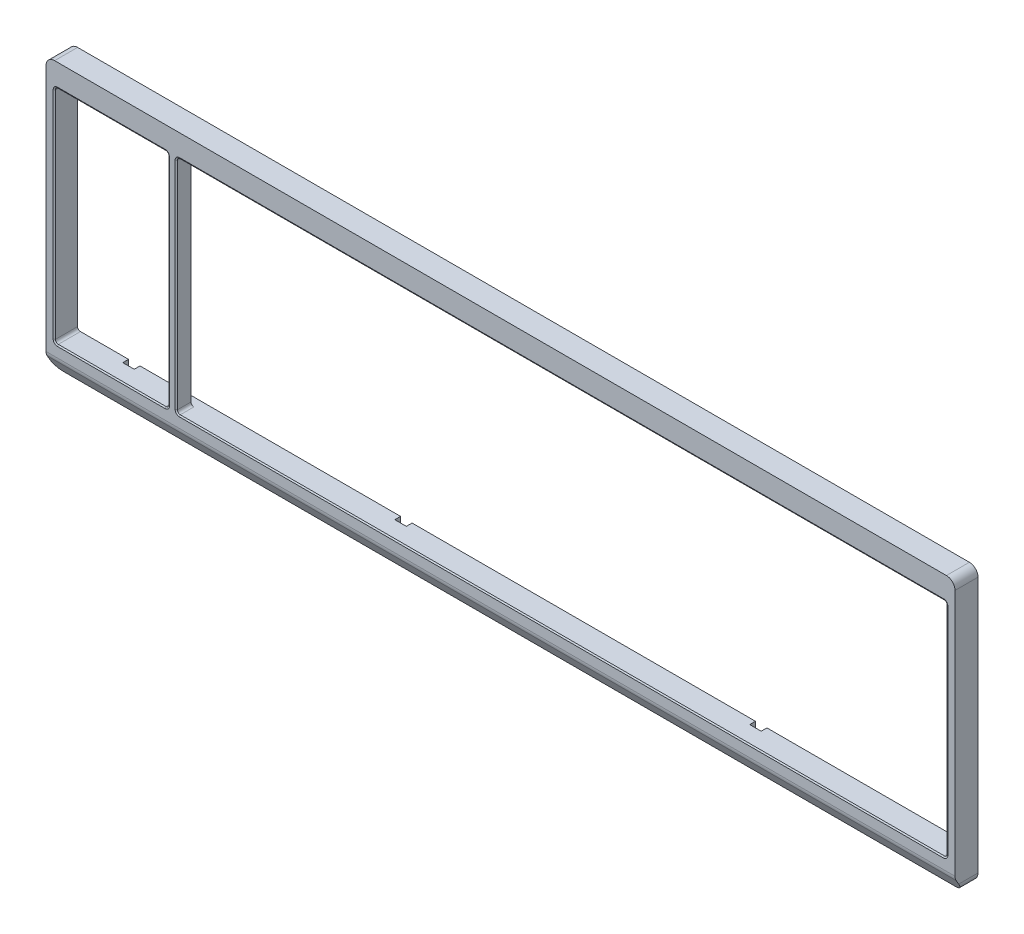
from build123d import *

# Parameters (mm, degrees)
SKETCH3_W                      = 316.5625
SKETCH3_H                      = 95.2
BOSS_EXTRUDE1_DEPTH            = 8
SKETCH3_3_W                    = 3
SKETCH3_3_H                    = 67.175
SKETCH3_3_H_2                  = 10.025
BOSS_EXTRUDE2_DEPTH            = 5
CHAMFER1_SIZE                  = 3
CHAMFER1_SIZE2                 = 5.196152423
FILLET3_R                      = 3
SKETCH8_R                      = 1.45
CUT_EXTRUDE1_DEPTH             = 2
SKETCH8_3_R                    = 1.45
CUT_EXTRUDE4_DEPTH             = 6
FILLET1_R                      = 3
FILLET5_R                      = 1
CHAMFER2_SIZE                  = 0.5
CHAMFER2_SIZE2                 = 0.288675135
FILLET6_R                      = 0.5
CBORE_FOR_M2_SHCS2_D           = 2.4
CBORE_FOR_M2_SHCS2_DEPTH       = 14.278967257
CBORE_FOR_M2_SHCS2_CBORE_D     = 4.4
CBORE_FOR_M2_SHCS2_CBORE_DEPTH = 4
CBORE_FOR_M2_SHCS2_TIP         = 0.721032743
HOLE_WIZARD_5794_D             = 2.4
HOLE_WIZARD_5794_DEPTH         = 8.278967257
HOLE_WIZARD_5794_CSINK_D       = 4.4
HOLE_WIZARD_5794_CSINK_ANGLE   = 90
HOLE_WIZARD_5794_TIP           = 0.721032743
SKETCH11_R                     = 1.45
CUT_EXTRUDE2_DEPTH             = 4
SKETCH11_3_R                   = 1.45
CUT_EXTRUDE3_DEPTH             = 4


with BuildPart() as part:
    # Sketch3 → Boss-Extrude1 (new body)
    with BuildSketch(Plane.XY):
        with Locations((154.78125, -39.1)):
            Rectangle(SKETCH3_W, SKETCH3_H)
        Polygon((38.98125, -76.7), (41.98125, -76.7), (310.0625, -76.7), (310.0625, 0.5), (41.98125, 0.5), (38.98125, 0.5), (-0.5, 0.5), (-0.5, -76.7), align=None, mode=Mode.SUBTRACT)
    extrude(amount=-BOSS_EXTRUDE1_DEPTH)

    # Sketch3<3> → Boss-Extrude2 (add)
    with BuildSketch(Plane.XY):
        with Locations((40.48125, -43.1125)):
            Rectangle(SKETCH3_3_W, SKETCH3_3_H)
        with Locations((40.48125, -4.5125)):
            Rectangle(SKETCH3_3_W, SKETCH3_3_H_2)
    extrude(amount=-BOSS_EXTRUDE2_DEPTH)

    # Chamfer1
    chamfer1_edges = [part.edges().sort_by_distance(p)[0] for p in [
        (154.78125, -86.7, 0),
    ]]
    chamfer1_side = [part.faces().sort_by_distance(p)[0] for p in [
        (154.78125, -86.7, -4),
    ]]
    chamfer(chamfer1_edges, length=CHAMFER1_SIZE, length2=CHAMFER1_SIZE2, reference=chamfer1_side[0])

    # Fillet3
    fillet3_edges = [part.edges().sort_by_distance(p)[0] for p in [
        (154.78125, -81.503847577, 0),
    ]]
    fillet(fillet3_edges, radius=FILLET3_R)

    # Sketch8 → Cut-Extrude1 (cut)
    # profile 1 of 8: a face of its own
    with BuildSketch(Plane(origin=(0, 0, -8), x_dir=(-1, 0, 0), z_dir=(0, 0, -1))):
        with BuildLine():
            Line((-260.0625, 0.5), (-260.0625, 4))
            ThreePointArc((-260.0625, 4), (-259.623160172, 5.060660172), (-258.5625, 5.5))
            Line((-258.5625, 5.5), (-257.5625, 5.5))
            ThreePointArc((-257.5625, 5.5), (-256.501839828, 5.060660172), (-256.0625, 4))
            Line((-256.0625, 4), (-256.0625, 0.5))
            Line((-256.0625, 0.5), (-260.0625, 0.5))
        make_face()
        with Locations((-258.0625, 2.8)):
            Circle(SKETCH8_R, mode=Mode.SUBTRACT)
    # profile 2 of 8: a face of its own
    with BuildSketch(Plane(origin=(0, 0, -8), x_dir=(-1, 0, 0), z_dir=(0, 0, -1))):
        with BuildLine():
            Line((-115.98125, -76.7), (-115.98125, -80.2))
            ThreePointArc((-115.98125, -80.2), (-115.541910172, -81.260660172), (-114.48125, -81.7))
            Line((-114.48125, -81.7), (-113.48125, -81.7))
            ThreePointArc((-113.48125, -81.7), (-112.420589828, -81.260660172), (-111.98125, -80.2))
            Line((-111.98125, -80.2), (-111.98125, -76.7))
            Line((-111.98125, -76.7), (-115.98125, -76.7))
        make_face()
        with Locations((-113.98125, -79)):
            Circle(SKETCH8_R, mode=Mode.SUBTRACT)
    # profile 3 of 8: a face of its own
    with BuildSketch(Plane(origin=(0, 0, -8), x_dir=(-1, 0, 0), z_dir=(0, 0, -1))):
        with BuildLine():
            Line((-210.0625, 0.5), (-210.0625, 4))
            ThreePointArc((-210.0625, 4), (-209.623160172, 5.060660172), (-208.5625, 5.5))
            Line((-208.5625, 5.5), (-207.5625, 5.5))
            ThreePointArc((-207.5625, 5.5), (-206.501839828, 5.060660172), (-206.0625, 4))
            Line((-206.0625, 4), (-206.0625, 0.5))
            Line((-206.0625, 0.5), (-210.0625, 0.5))
        make_face()
        with Locations((-208.0625, 2.8)):
            Circle(SKETCH8_R, mode=Mode.SUBTRACT)
    # profile 4 of 8: a face of its own
    with BuildSketch(Plane(origin=(0, 0, -8), x_dir=(-1, 0, 0), z_dir=(0, 0, -1))):
        with BuildLine():
            Line((-130.98125, 0.5), (-130.98125, 4))
            ThreePointArc((-130.98125, 4), (-130.541910172, 5.060660172), (-129.48125, 5.5))
            Line((-129.48125, 5.5), (-128.48125, 5.5))
            ThreePointArc((-128.48125, 5.5), (-127.420589828, 5.060660172), (-126.98125, 4))
            Line((-126.98125, 4), (-126.98125, 0.5))
            Line((-126.98125, 0.5), (-130.98125, 0.5))
        make_face()
        with Locations((-128.98125, 2.8)):
            Circle(SKETCH8_R, mode=Mode.SUBTRACT)
    # profile 5 of 8: a face of its own
    with BuildSketch(Plane(origin=(0, 0, -8), x_dir=(-1, 0, 0), z_dir=(0, 0, -1))):
        with BuildLine():
            Line((-85.98125, 0.5), (-85.98125, 4))
            ThreePointArc((-85.98125, 4), (-85.541910172, 5.060660172), (-84.48125, 5.5))
            Line((-84.48125, 5.5), (-83.48125, 5.5))
            ThreePointArc((-83.48125, 5.5), (-82.420589828, 5.060660172), (-81.98125, 4))
            Line((-81.98125, 4), (-81.98125, 0.5))
            Line((-81.98125, 0.5), (-85.98125, 0.5))
        make_face()
        with Locations((-83.98125, 2.8)):
            Circle(SKETCH8_R, mode=Mode.SUBTRACT)
    # profile 6 of 8: a face of its own
    with BuildSketch(Plane(origin=(0, 0, -8), x_dir=(-1, 0, 0), z_dir=(0, 0, -1))):
        with BuildLine():
            Line((-21.240625, 0.5), (-21.240625, 4))
            ThreePointArc((-21.240625, 4), (-20.801285172, 5.060660172), (-19.740625, 5.5))
            Line((-19.740625, 5.5), (-18.740625, 5.5))
            ThreePointArc((-18.740625, 5.5), (-17.679964828, 5.060660172), (-17.240625, 4))
            Line((-17.240625, 4), (-17.240625, 0.5))
            Line((-17.240625, 0.5), (-21.240625, 0.5))
        make_face()
        with Locations((-19.240625, 2.8)):
            Circle(SKETCH8_R, mode=Mode.SUBTRACT)
    # profile 7 of 8: a face of its own
    with BuildSketch(Plane(origin=(0, 0, -8), x_dir=(-1, 0, 0), z_dir=(0, 0, -1))):
        with BuildLine():
            Line((-239.5625, -76.7), (-239.5625, -80.2))
            ThreePointArc((-239.5625, -80.2), (-239.123160172, -81.260660172), (-238.0625, -81.7))
            Line((-238.0625, -81.7), (-237.0625, -81.7))
            ThreePointArc((-237.0625, -81.7), (-236.001839828, -81.260660172), (-235.5625, -80.2))
            Line((-235.5625, -80.2), (-235.5625, -76.7))
            Line((-235.5625, -76.7), (-239.5625, -76.7))
        make_face()
        with Locations((-237.5625, -79)):
            Circle(SKETCH8_R, mode=Mode.SUBTRACT)
    # profile 8 of 8: a face of its own
    with BuildSketch(Plane(origin=(0, 0, -8), x_dir=(-1, 0, 0), z_dir=(0, 0, -1))):
        with BuildLine():
            Line((-21.240625, -76.7), (-21.240625, -80.2))
            ThreePointArc((-21.240625, -80.2), (-20.801285172, -81.260660172), (-19.740625, -81.7))
            Line((-19.740625, -81.7), (-18.740625, -81.7))
            ThreePointArc((-18.740625, -81.7), (-17.679964828, -81.260660172), (-17.240625, -80.2))
            Line((-17.240625, -80.2), (-17.240625, -76.7))
            Line((-17.240625, -76.7), (-21.240625, -76.7))
        make_face()
        with Locations((-19.240625, -79)):
            Circle(SKETCH8_R, mode=Mode.SUBTRACT)
    extrude(amount=-CUT_EXTRUDE1_DEPTH, mode=Mode.SUBTRACT)

    # Sketch8<3> → Cut-Extrude4 (cut)
    with BuildSketch(Plane(origin=(0, 0, -8), x_dir=(-1, 0, 0), z_dir=(0, 0, -1))):
        with Locations((-258.0625, 2.8)):
            Circle(SKETCH8_3_R)
        with Locations((-208.0625, 2.8)):
            Circle(SKETCH8_3_R)
        with Locations((-128.98125, 2.8)):
            Circle(SKETCH8_3_R)
        with Locations((-83.98125, 2.8)):
            Circle(SKETCH8_3_R)
        with Locations((-19.240625, 2.8)):
            Circle(SKETCH8_3_R)
        with Locations((-19.240625, -79)):
            Circle(SKETCH8_3_R)
        with Locations((-113.98125, -79)):
            Circle(SKETCH8_3_R)
        with Locations((-237.5625, -79)):
            Circle(SKETCH8_3_R)
    extrude(amount=-CUT_EXTRUDE4_DEPTH, mode=Mode.SUBTRACT)

    # Fillet1
    fillet1_edges = [part.edges().sort_by_distance(p)[0] for p in [
        (313.0625, -86.7, -5.5),
        (-3.5, -86.7, -5.5),
        (-3.5, 8.5, -4),
        (313.0625, 8.5, -4),
    ]]
    fillet(fillet1_edges, radius=FILLET1_R)

    # Fillet5
    fillet5_edges = [part.edges().sort_by_distance(p)[0] for p in [
        (310.0625, -76.7, -4),
        (310.0625, 0.5, -4),
        (-0.5, 0.5, -4),
        (-0.5, -76.7, -4),
        (41.98125, 0.5, -2.5),
        (41.98125, -76.7, -2.5),
        (38.98125, -76.7, -2.5),
        (38.98125, 0.5, -2.5),
    ]]
    fillet(fillet5_edges, radius=FILLET5_R)

    # Chamfer2
    chamfer2_edges = [part.edges().sort_by_distance(p)[0] for p in [
        (310.0625, -38.1, 0),
        (19.240625, -76.7, 0),
        (176.021875, -76.7, 0),
        (176.021875, 0.5, 0),
        (19.240625, 0.5, 0),
        (41.98125, -38.1, 0),
        (38.98125, -38.1, 0),
        (-0.5, -38.1, 0),
        (309.769606781, -76.407106781, 0),
        (309.769606781, 0.207106781, 0),
        (42.274143219, 0.207106781, 0),
        (42.274143219, -76.407106781, 0),
        (38.688356781, -76.407106781, 0),
        (-0.207106781, -76.407106781, 0),
        (-0.207106781, 0.207106781, 0),
        (38.688356781, 0.207106781, 0),
    ]]
    chamfer2_side = [part.faces().sort_by_distance(p)[0] for p in [
        (310.391389733, -38.1, 0),
    ]]
    chamfer(chamfer2_edges, length=CHAMFER2_SIZE, length2=CHAMFER2_SIZE2, reference=chamfer2_side[0])

    # Fillet6
    fillet6_edges = [part.edges().sort_by_distance(p)[0] for p in [
        (256.0625, 0.5, -7),
        (260.0625, 0.5, -7),
    ]]
    fillet(fillet6_edges, radius=FILLET6_R)

    # CBORE for M2 SHCS2
    with Locations(Plane(origin=(0, -0.720708302, -17.082674747), x_dir=(-1, 0, 0), z_dir=(0, 0, -1))):
        with Locations((-304.78125, 3.743540113), (-4.78125, 3.743540113), (-289.78125, 3.743540113), (-12.78125, 3.743540113)):
            CounterBoreHole(CBORE_FOR_M2_SHCS2_D / 2, CBORE_FOR_M2_SHCS2_CBORE_D / 2, CBORE_FOR_M2_SHCS2_CBORE_DEPTH, depth=CBORE_FOR_M2_SHCS2_DEPTH)
            with Locations((0, 0, -(CBORE_FOR_M2_SHCS2_DEPTH + CBORE_FOR_M2_SHCS2_TIP / 2))):  # 118° drill point
                Cone(0, CBORE_FOR_M2_SHCS2_D / 2, CBORE_FOR_M2_SHCS2_TIP, mode=Mode.SUBTRACT)

    # Hole Wizard 5794
    with Locations(Plane(origin=(0, 0, -9.799622892), x_dir=(1, 0, 0), z_dir=(0, 0, -1))):
        with Locations((4.78125, 80.87420884), (304.78125, 80.87420884), (289.78125, 80.87420884), (12.78125, 80.87420884)):
            CounterSinkHole(HOLE_WIZARD_5794_D / 2, HOLE_WIZARD_5794_CSINK_D / 2, depth=HOLE_WIZARD_5794_DEPTH, counter_sink_angle=HOLE_WIZARD_5794_CSINK_ANGLE)
            with Locations((0, 0, -(HOLE_WIZARD_5794_DEPTH + HOLE_WIZARD_5794_TIP / 2))):  # 118° drill point
                Cone(0, HOLE_WIZARD_5794_D / 2, HOLE_WIZARD_5794_TIP, mode=Mode.SUBTRACT)

    # Sketch11 → Cut-Extrude2 (cut)
    with BuildSketch(Plane(origin=(0, 0, -8), x_dir=(-1, 0, 0), z_dir=(0, 0, -1))):
        with Locations((-304.78125, 3.022831811)):
            Circle(SKETCH11_R)
        with Locations((-289.78125, 3.022831811)):
            Circle(SKETCH11_R)
        with Locations((-12.78125, 3.022831811)):
            Circle(SKETCH11_R)
        with Locations((-4.78125, 3.022831811)):
            Circle(SKETCH11_R)
    extrude(amount=-CUT_EXTRUDE2_DEPTH, mode=Mode.SUBTRACT)

    # Sketch11<3> → Cut-Extrude3 (cut)
    with BuildSketch(Plane(origin=(0, 0, -8), x_dir=(-1, 0, 0), z_dir=(0, 0, -1))):
        with Locations((-304.78125, 3.022831811)):
            Circle(SKETCH11_3_R)
        with Locations((-289.78125, 3.022831811)):
            Circle(SKETCH11_3_R)
        with Locations((-12.78125, 3.022831811)):
            Circle(SKETCH11_3_R)
        with Locations((-4.78125, 3.022831811)):
            Circle(SKETCH11_3_R)
        with Locations((-4.78125, -80.87420884)):
            Circle(SKETCH11_3_R)
        with Locations((-12.78125, -80.87420884)):
            Circle(SKETCH11_3_R)
        with Locations((-289.78125, -80.87420884)):
            Circle(SKETCH11_3_R)
        with Locations((-304.78125, -80.87420884)):
            Circle(SKETCH11_3_R)
    extrude(amount=-CUT_EXTRUDE3_DEPTH, mode=Mode.SUBTRACT)


solid = part.part
